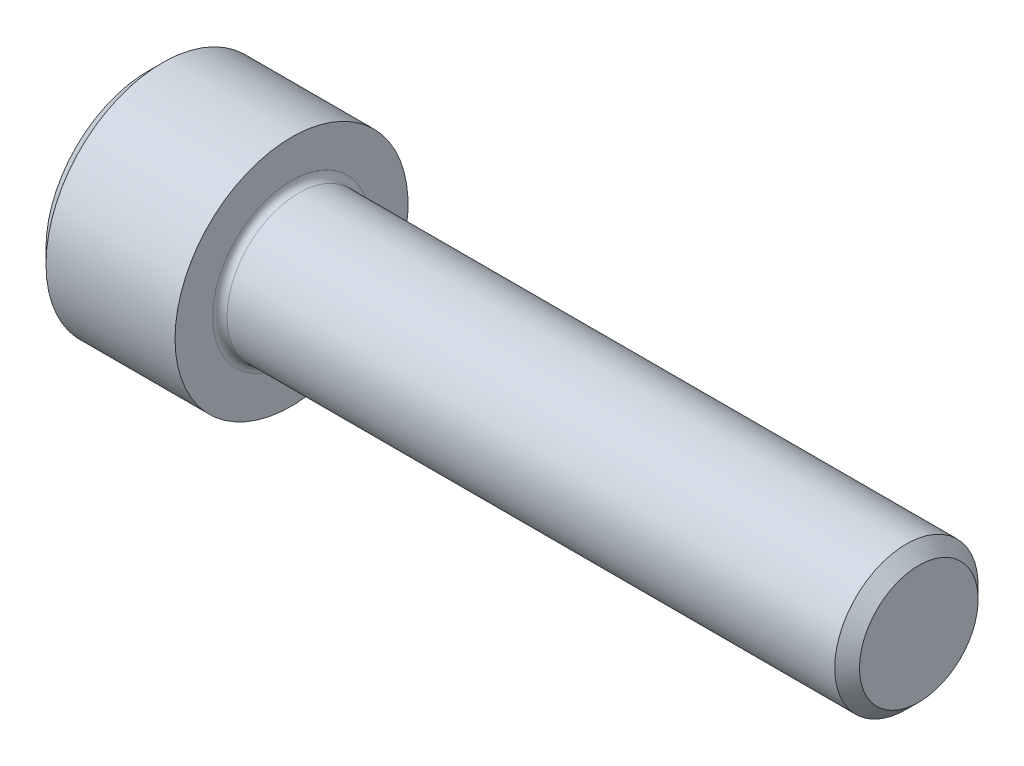
from build123d import *

# Parameters (mm, degrees)
FILLET1_R   = 0.4
HEX_2_DEPTH = 4


with BuildPart() as part:
    # BodySke → Base-Revolve (revolve)
    with BuildSketch(Plane.XY, mode=Mode.PRIVATE) as base_revolve_sk:
        Polygon((0, 0), (0, 5.7), (0.8, 6.5), (8, 6.5), (8, 4), (42.3095, 4), (43, 3.3095), (43, 0), align=None)
    revolve(base_revolve_sk.sketch.rotate(Axis((-31.75, 0, 0), (1, 0, 0)), 90), axis=Axis((-31.75, 0, 0), (1, 0, 0)))

    # Fillet1
    fillet1_edges = [part.edges().sort_by_distance(p)[0] for p in [
        (8, 0, -4),
    ]]
    fillet(fillet1_edges, radius=FILLET1_R)

    # Sketch2 → Hex-PreBroach (revolve, cut)
    with BuildSketch(Plane.XY, mode=Mode.PRIVATE) as hex_prebroach_sk:
        Polygon((0, 3.0475), (4, 3.0475), (5.759474945, 0), (0, 0), align=None)
    revolve(hex_prebroach_sk.sketch.rotate(Axis((0, 0, 0), (1, 0, 0)), 90), axis=Axis((0, 0, 0), (1, 0, 0)), mode=Mode.SUBTRACT)

    # Sketch3 → Hex 2 (cut)
    with BuildSketch(Plane(origin=(0, 0, 0), x_dir=(0, 0.500000000000001, 0.866025403784438), z_dir=(-1, 0, 0))):
        Polygon((1.759474945, 3.0475), (-1.759474945, 3.0475), (-3.518949891, 0), (-1.759474945, -3.0475), (1.759474945, -3.0475), (3.518949891, 0), align=None)
    extrude(amount=-HEX_2_DEPTH, mode=Mode.SUBTRACT)


solid = part.part
